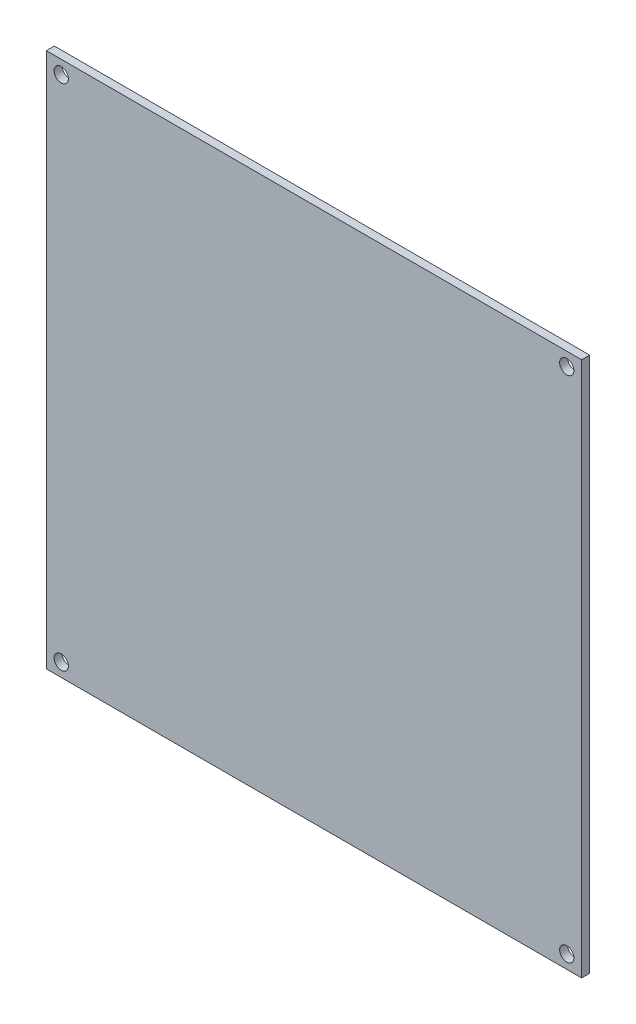
from build123d import *

# Parameters (mm, degrees)
SKETCH1_W           = 120
SKETCH1_H           = 120
SKETCH1_R           = 1.6
BOSS_EXTRUDE1_DEPTH = 1.8


with BuildPart() as part:
    # Sketch1 → Boss-Extrude1 (new body)
    with BuildSketch(Plane.XY):
        with Locations((60, 60)):
            Rectangle(SKETCH1_W, SKETCH1_H)
        with Locations((3.35, 117)):
            Circle(SKETCH1_R, mode=Mode.SUBTRACT)
        with Locations((116.65, 117)):
            Circle(SKETCH1_R, mode=Mode.SUBTRACT)
        with Locations((116.65, 3)):
            Circle(SKETCH1_R, mode=Mode.SUBTRACT)
        with Locations((3.35, 3)):
            Circle(SKETCH1_R, mode=Mode.SUBTRACT)
    extrude(amount=BOSS_EXTRUDE1_DEPTH)


solid = part.part
